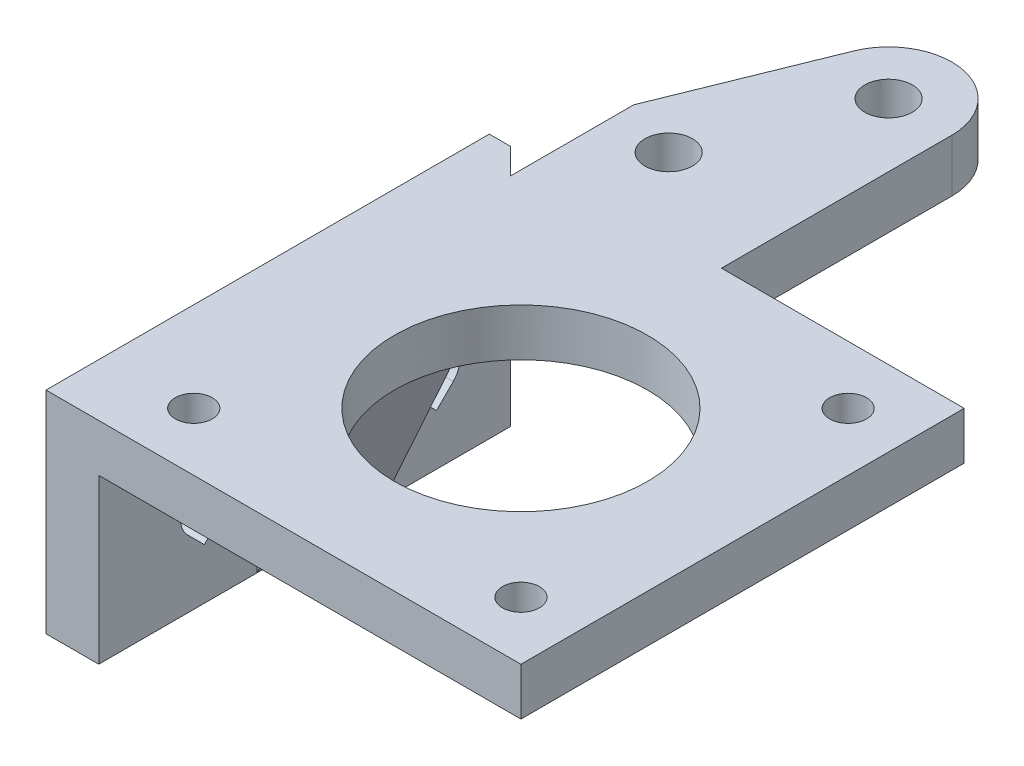
from build123d import *

# Parameters (mm, degrees)
BOSS_EXTRUDE1_DEPTH = 21
CUT_EXTRUDE1_REACH  = 55.535
SKETCH2_R           = 12
SKETCH2_R_2         = 1.75
BOSS_EXTRUDE2_DEPTH = 6
CUT_EXTRUDE2_DEPTH  = 50.406477308
SKETCH5_R           = 2.25
BOSS_EXTRUDE3_DEPTH = 4.5
CHAMFER1_SIZE       = 3
SKETCH6_R           = 2.25
BOSS_EXTRUDE4_DEPTH = 0.5


with BuildPart() as part:
    # Sketch1 → Boss-Extrude1 (new, symmetric)
    with BuildSketch(Plane.XY):
        Polygon((0, 0), (45, 0), (45, -4.5), (5, -4.5), (5, -20), (0, -20), align=None)
    extrude(amount=BOSS_EXTRUDE1_DEPTH, both=True)

    # Sketch2 → Cut-Extrude1 (cut, up to next)
    with BuildSketch(Plane(origin=(0, 0, 0), x_dir=(1, 0, 0), z_dir=(0, 1, 0)), mode=Mode.PRIVATE) as cut_extrude1_sk1:
        with Locations(Location((24, 0, 0), (0, 0, 270))):
            Circle(SKETCH2_R)
    cut_extrude1_tool1 = extrude(cut_extrude1_sk1.sketch, amount=-CUT_EXTRUDE1_REACH, mode=Mode.PRIVATE) & part.part
    # Sketch2 → Cut-Extrude1 (cut, up to next)
    with BuildSketch(Plane(origin=(0, 0, 0), x_dir=(1, 0, 0), z_dir=(0, 1, 0)), mode=Mode.PRIVATE) as cut_extrude1_sk2:
        with Locations(Location((39.5, 15.5, 0), (0, 0, 270))):
            Circle(SKETCH2_R_2)
    cut_extrude1_tool2 = extrude(cut_extrude1_sk2.sketch, amount=-CUT_EXTRUDE1_REACH, mode=Mode.PRIVATE) & part.part
    # Sketch2 → Cut-Extrude1 (cut, up to next)
    with BuildSketch(Plane(origin=(0, 0, 0), x_dir=(1, 0, 0), z_dir=(0, 1, 0)), mode=Mode.PRIVATE) as cut_extrude1_sk3:
        with Locations(Location((8.5, -15.5, 0), (0, 0, 270))):
            Circle(SKETCH2_R_2)
    cut_extrude1_tool3 = extrude(cut_extrude1_sk3.sketch, amount=-CUT_EXTRUDE1_REACH, mode=Mode.PRIVATE) & part.part
    # Sketch2 → Cut-Extrude1 (cut, up to next)
    with BuildSketch(Plane(origin=(0, 0, 0), x_dir=(1, 0, 0), z_dir=(0, 1, 0)), mode=Mode.PRIVATE) as cut_extrude1_sk4:
        with Locations(Location((39.5, -15.5, 0), (0, 0, 270))):
            Circle(SKETCH2_R_2)
    cut_extrude1_tool4 = extrude(cut_extrude1_sk4.sketch, amount=-CUT_EXTRUDE1_REACH, mode=Mode.PRIVATE) & part.part
    add(cut_extrude1_tool1.solids().sort_by_distance((24, 0, 0))[0], mode=Mode.SUBTRACT)
    add(cut_extrude1_tool2.solids().sort_by_distance((39.5, 0, -15.5))[0], mode=Mode.SUBTRACT)
    add(cut_extrude1_tool3.solids().sort_by_distance((8.5, 0, 15.5))[0], mode=Mode.SUBTRACT)
    add(cut_extrude1_tool4.solids().sort_by_distance((39.5, 0, 15.5))[0], mode=Mode.SUBTRACT)

    # Sketch3 → Boss-Extrude2 (add, symmetric)
    with BuildSketch(Plane.XY):
        Polygon((5, -20), (12, -4.5), (5, -4.5), align=None)
    extrude(amount=BOSS_EXTRUDE2_DEPTH, both=True)

    # Sketch4 → Cut-Extrude2 (cut, through all)
    with BuildSketch(Plane(origin=(5, 0, 0), x_dir=(0, 0, -1), z_dir=(1, 0, 0))):
        with BuildLine():
            Line((9.409009742, -13.590990258), (11, -15.181980515))
            Line((11, -15.181980515), (12.590990258, -13.590990258))
            ThreePointArc((12.590990258, -13.590990258), (11, -9.75), (9.409009742, -13.590990258))
        make_face()
        with BuildLine():
            Line((-12.590990258, -13.590990258), (-11, -15.181980515))
            Line((-11, -15.181980515), (-9.409009742, -13.590990258))
            ThreePointArc((-9.409009742, -13.590990258), (-11, -9.75), (-12.590990258, -13.590990258))
        make_face()
    extrude(amount=-CUT_EXTRUDE2_DEPTH, mode=Mode.SUBTRACT)

    # Sketch5 → Boss-Extrude3 (add)
    with BuildSketch(Plane(origin=(0, 0, 0), x_dir=(1, 0, 0), z_dir=(0, 1, 0))):
        with BuildLine():
            Line((4.437851135, 30.25), (10.437851135, 45.082396974))
            ThreePointArc((10.437851135, 45.082396974), (17.146103575, 48.721917039), (22, 42.832396974))
            Line((22, 42.832396974), (22, 21))
            Line((22, 21), (4.437851135, 21))
            Line((4.437851135, 21), (4.437851135, 30.25))
        make_face()
        with Locations(Location((10, 28, 0), (0, 0, 270))):
            Circle(SKETCH5_R, mode=Mode.SUBTRACT)
        with Locations(Location((16, 42.832396974, 0), (0, 0, 270))):
            Circle(SKETCH5_R, mode=Mode.SUBTRACT)
    extrude(amount=-BOSS_EXTRUDE3_DEPTH)

    # Chamfer1
    chamfer1_edges = [part.edges().sort_by_distance(p)[0] for p in [
        (5, -12.25, -21),
    ]]
    chamfer(chamfer1_edges, length=CHAMFER1_SIZE)

    # Sketch6 → Boss-Extrude4 (add)
    with BuildSketch(Plane.XZ.offset(4.5)):
        with BuildLine():
            Line((5, -18), (22, -21))
            Line((22, -21), (22, -42.832396974))
            ThreePointArc((22, -42.832396974), (17.146103575, -48.721917039), (10.437851135, -45.082396974))
            Line((10.437851135, -45.082396974), (4.437851135, -30.25))
            Line((4.437851135, -30.25), (4.437851135, -18.562148865))
            Line((4.437851135, -18.562148865), (5, -18))
        make_face()
        with Locations(Location((10, -28, 0), (0, 0, 90))):
            Circle(SKETCH6_R, mode=Mode.SUBTRACT)
        with Locations(Location((16, -42.832396974, 0), (0, 0, 90))):
            Circle(SKETCH6_R, mode=Mode.SUBTRACT)
    extrude(amount=BOSS_EXTRUDE4_DEPTH)


solid = part.part
